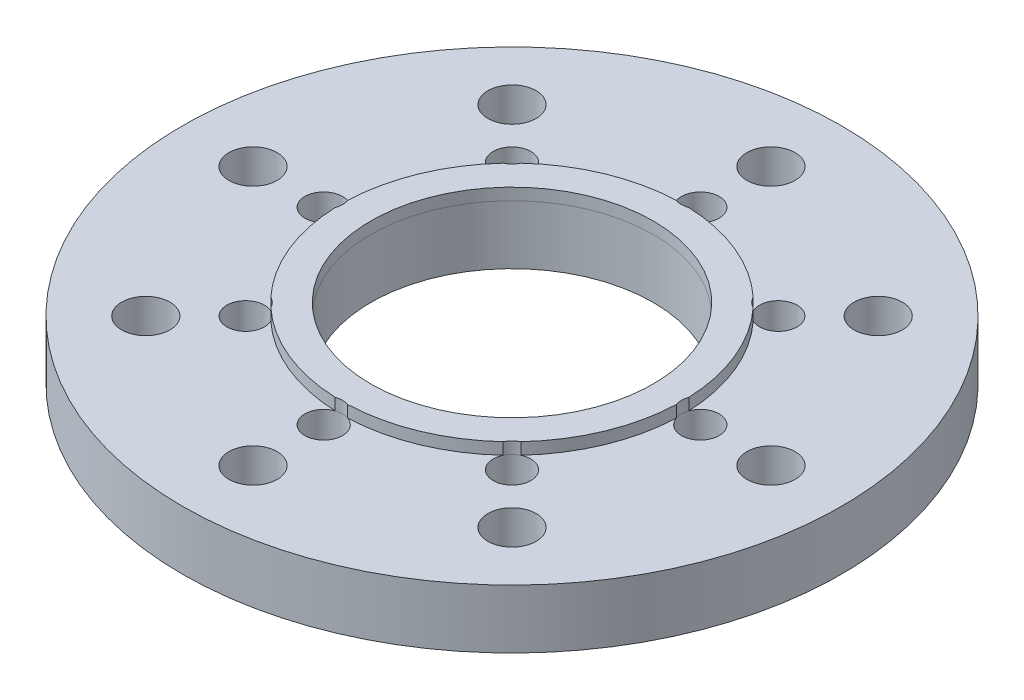
from build123d import *

# Parameters (mm, degrees)
SKETCH1_R           = 14
SKETCH1_R_2         = 6
BOSS_EXTRUDE1_DEPTH = 2.5
SKETCH5_R           = 7.25
SKETCH5_R_2         = 6
BOSS_EXTRUDE2_DEPTH = 0.5
SKETCH10_W          = 1.025
SKETCH10_H          = 2.5
CIRPATTERN3_COUNT   = 8
SKETCH20_W          = 0.8
SKETCH20_H          = 3
CIRPATTERN4_COUNT   = 8


with BuildPart() as part:
    # Sketch1 → Boss-Extrude1 (new body)
    with BuildSketch(Plane(origin=(0, 0, 0), x_dir=(1, 0, 0), z_dir=(0, 1, 0))):
        with Locations(Location((0, 0, 0), (0, 0, 270))):
            Circle(SKETCH1_R)
        with Locations(Location((0, 0, 0), (0, 0, 270))):
            Circle(SKETCH1_R_2, mode=Mode.SUBTRACT)
    extrude(amount=BOSS_EXTRUDE1_DEPTH)

    # Sketch10 → M2.5 Tapped Hole1 (revolve, cut)
    with BuildSketch(Plane(origin=(0, 0, 11), x_dir=(0, 0, -1), z_dir=(1, 0, 0))):
        with Locations((0.5125, 1.25)):
            Rectangle(SKETCH10_W, SKETCH10_H)
    m2_5_tapped_hole1 = revolve(axis=Axis((0, -6.35, 11), (0, 1, 0)), mode=Mode.SUBTRACT)

    # CirPattern3: M2.5 Tapped Hole1 ×8 about axis
    cirpattern3_axis = Axis((0, 0, 0), (0, 1, 0))
    for i in range(1, CIRPATTERN3_COUNT):
        add(m2_5_tapped_hole1.rotate(cirpattern3_axis, i * 360 / CIRPATTERN3_COUNT), mode=Mode.SUBTRACT)


with BuildPart() as body_2:
    # Sketch5 → Boss-Extrude2 (new body)
    with BuildSketch(Plane(origin=(0, 2.5, 0), x_dir=(1, 0, 0), z_dir=(0, 1, 0))):
        with Locations(Location((0, 0, 0), (0, 0, 270))):
            Circle(SKETCH5_R)
        with Locations(Location((0, 0, 0), (0, 0, 270))):
            Circle(SKETCH5_R_2, mode=Mode.SUBTRACT)
    extrude(amount=BOSS_EXTRUDE2_DEPTH)


with BuildPart() as m2_tapped_hole1_tool:
    # Sketch20 → M2 Tapped Hole1 (revolve)
    with BuildSketch(Plane(origin=(0, 3, -8), x_dir=(0, 0, 1), z_dir=(1, 0, 0))):
        with Locations((0.4, 1.5)):
            Rectangle(SKETCH20_W, SKETCH20_H)
    m2_tapped_hole1 = revolve(axis=Axis((0, 9.35, -8), (0, -1, 0)))


with BuildPart() as part_1:
    add(part.part)

    # M2 Tapped Hole1: cut by m2_tapped_hole1_tool
    add(m2_tapped_hole1_tool.part, mode=Mode.SUBTRACT)


with BuildPart() as body_2_1:
    add(body_2.part)

    # M2 Tapped Hole1: cut by m2_tapped_hole1_tool
    add(m2_tapped_hole1_tool.part, mode=Mode.SUBTRACT)


with BuildPart() as cirpattern4_tool:
    # CirPattern4: M2 Tapped Hole1 ×8 about axis
    cirpattern4_axis = Axis((0, 0, 0), (0, 1, 0))
    for i in range(1, CIRPATTERN4_COUNT):
        add(m2_tapped_hole1.rotate(cirpattern4_axis, i * 360 / CIRPATTERN4_COUNT))


with BuildPart() as part_2:
    add(part_1.part)

    # CirPattern4: cut by cirpattern4_tool
    add(cirpattern4_tool.part, mode=Mode.SUBTRACT)


with BuildPart() as body_2_2:
    add(body_2_1.part)

    # CirPattern4: cut by cirpattern4_tool
    add(cirpattern4_tool.part, mode=Mode.SUBTRACT)


solid = Compound([part_2.part, body_2_2.part])
